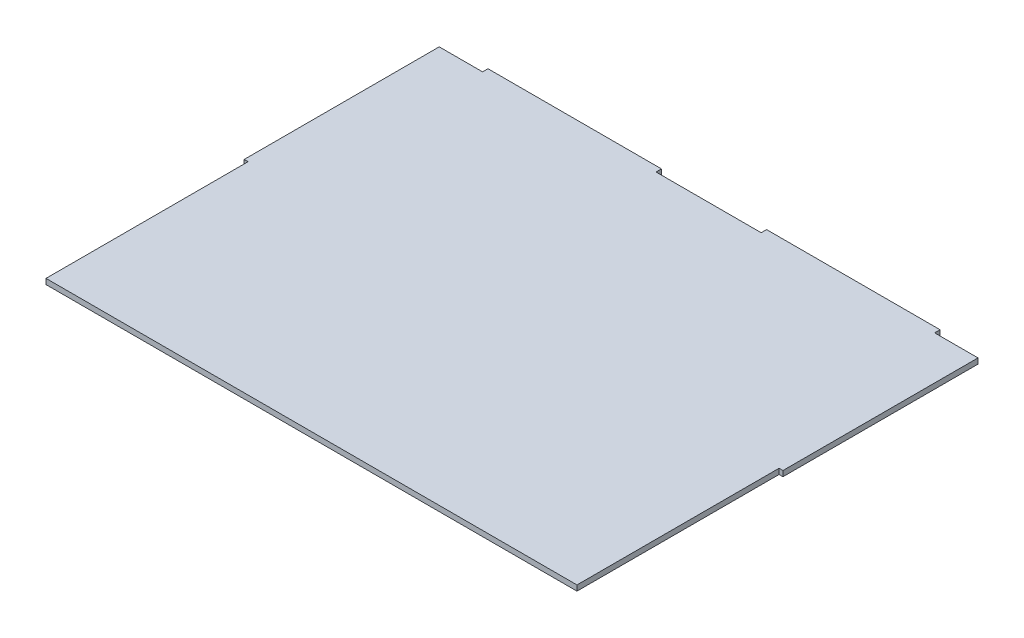
from build123d import *

# Parameters (mm, degrees)
SKETCH1_W           = 315.575
SKETCH1_H           = 3.175
BOSS_EXTRUDE1_DEPTH = 235.775
SKETCH3_W           = 25.4
SKETCH3_H           = 3.175
SKETCH3_W_2         = 61.575
CUT_EXTRUDE1_DEPTH  = 3.175
CUT_EXTRUDE2_START  = -3.175
SKETCH5_W           = 2.286
SKETCH5_H           = 118.364
CUT_EXTRUDE2_DEPTH  = 287.894626403


with BuildPart() as part:
    # Sketch1 → Boss-Extrude1 (new body)
    with BuildSketch(Plane.XY):
        Rectangle(SKETCH1_W, SKETCH1_H)
    extrude(amount=BOSS_EXTRUDE1_DEPTH)

    # Sketch3 → Cut-Extrude1 (cut)
    with BuildSketch(Plane(origin=(0, 0, 0), x_dir=(-1, 0, 0), z_dir=(0, 0, -1))):
        with Locations((-145.0875, 0)):
            Rectangle(SKETCH3_W, SKETCH3_H)
        Rectangle(SKETCH3_W_2, SKETCH3_H)
        with Locations((145.0875, 0)):
            Rectangle(SKETCH3_W, SKETCH3_H)
    extrude(amount=-CUT_EXTRUDE1_DEPTH, mode=Mode.SUBTRACT)

    # Sketch5 → Cut-Extrude2 (cut)
    with BuildSketch(Plane(origin=(0, 1.5875, 0), x_dir=(1, 0, 0), z_dir=(0, 1, 0)).offset(CUT_EXTRUDE2_START)):
        with Locations((-156.6445, -176.593)):
            Rectangle(SKETCH5_W, SKETCH5_H)
    cut_extrude2 = extrude(amount=CUT_EXTRUDE2_DEPTH, mode=Mode.SUBTRACT)

    # Mirror1: Cut-Extrude2 across plane
    add(cut_extrude2.mirror(Plane(origin=(0, 0, 0), x_dir=(0, 0, 1), z_dir=(1, 0, 0))), mode=Mode.SUBTRACT)


solid = part.part
